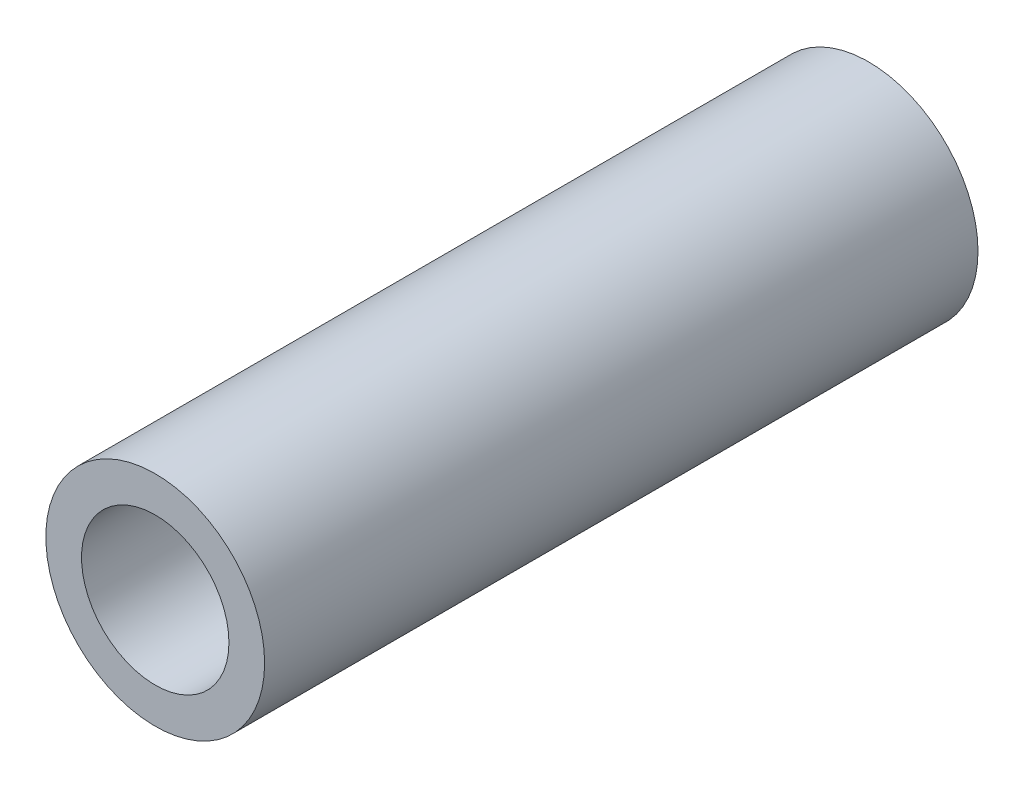
from build123d import *

# Parameters (mm, degrees)
SKETCH1_R           = 2.3
SKETCH1_R_2         = 1.55
BOSS_EXTRUDE1_DEPTH = 15


with BuildPart() as part:
    # Sketch1 → Boss-Extrude1 (new body)
    with BuildSketch(Plane.XY):
        Circle(SKETCH1_R)
        Circle(SKETCH1_R_2, mode=Mode.SUBTRACT)
    extrude(amount=BOSS_EXTRUDE1_DEPTH)


solid = part.part
